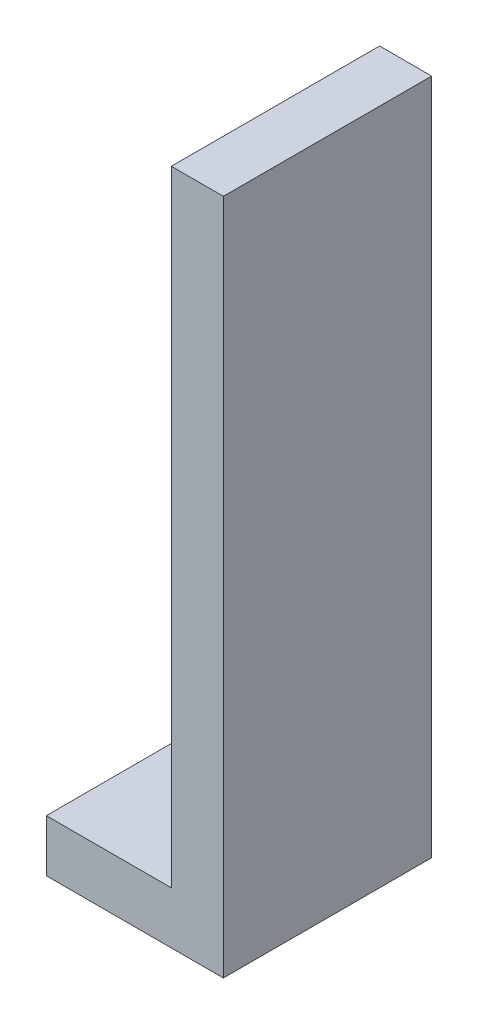
from build123d import *

# Parameters (mm, degrees)
Y_KSEKLIK_EKSTR_ZYON1_DEPTH = 20
IZIM2_R                     = 1.7
KES_EKSTR_ZYON1_DEPTH       = 20
IZIM3_W                     = 23.754432013
IZIM3_H                     = 26.439090975
KES_EKSTR_ZYON2_DEPTH       = 82


with BuildPart() as part:
    # Çizim1 → Yükseklik-Ekstrüzyon1 (new body)
    with BuildSketch(Plane.XY):
        Polygon((0, 0), (12, 0), (12, -5), (-5, -5), (-5, 60), (0, 60), align=None)
    y_kseklik_ekstr_zyon1 = extrude(amount=Y_KSEKLIK_EKSTR_ZYON1_DEPTH)

    # Çizim2 → Kes-Ekstrüzyon1 (cut)
    with BuildSketch(Plane(origin=(0, 0, 0), x_dir=(1, 0, 0), z_dir=(0, 1, 0))):
        with Locations(Location((6, -10, 0), (0, 0, 270))):
            Circle(IZIM2_R)
    kes_ekstr_zyon1 = extrude(amount=-KES_EKSTR_ZYON1_DEPTH, mode=Mode.SUBTRACT)

    # Aynalama1: Yükseklik-Ekstrüzyon1, Kes-Ekstrüzyon1 across plane
    add(y_kseklik_ekstr_zyon1.mirror(Plane(origin=(-5, 0, 0), x_dir=(0, 0, 1), z_dir=(1, 0, 0))))
    add(kes_ekstr_zyon1.mirror(Plane(origin=(-5, 0, 0), x_dir=(0, 0, 1), z_dir=(1, 0, 0))), mode=Mode.SUBTRACT)

    # Çizim3 → Kes-Ekstrüzyon2 (cut)
    with BuildSketch(Plane.XZ.offset(5)):
        with Locations((6.877216007, 6.780454513)):
            Rectangle(IZIM3_W, IZIM3_H)
    extrude(amount=-KES_EKSTR_ZYON2_DEPTH, mode=Mode.SUBTRACT)


solid = part.part
